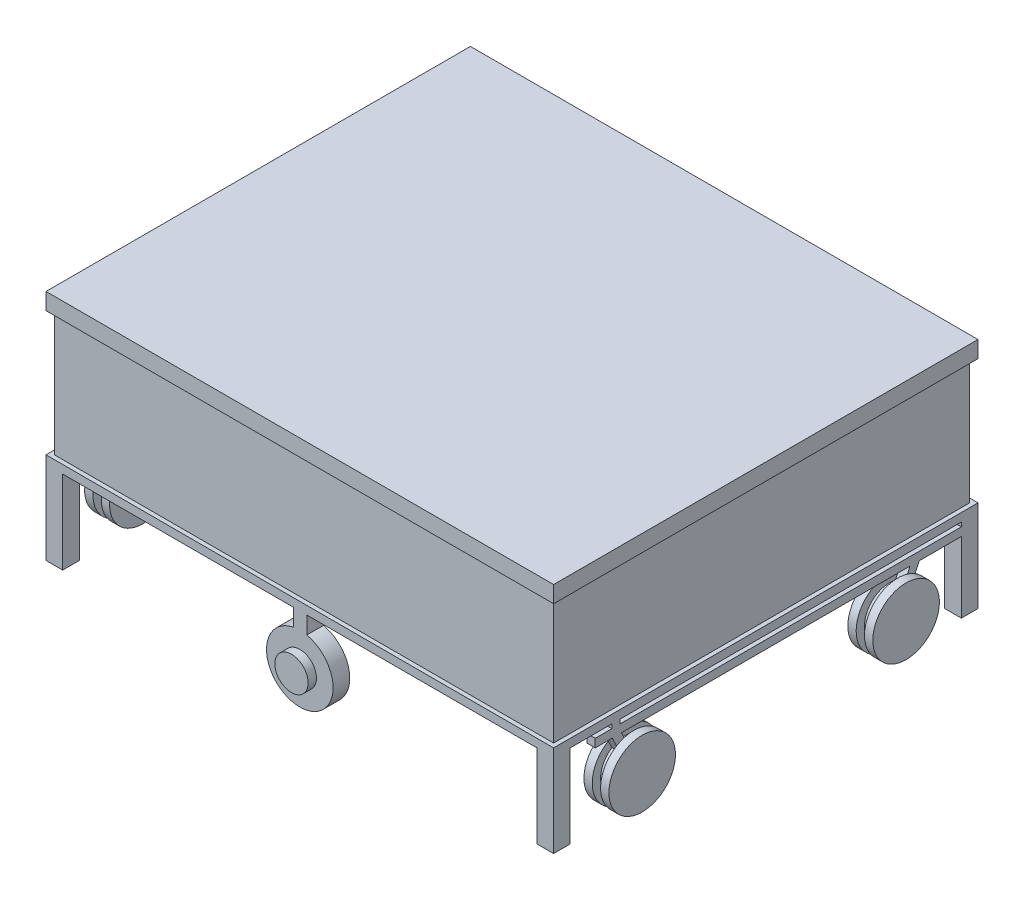
from build123d import *

# Parameters (mm, degrees)
SKETCH2_W            = 610
SKETCH2_H            = 110
BOSS_EXTRUDE1_DEPTH  = 510
SKETCH3_W            = 500
SKETCH3_H            = 470
CUT_EXTRUDE1_DEPTH   = 510
SKETCH4_W            = 570
SKETCH4_H            = 100
CUT_EXTRUDE2_DEPTH   = 510
SKETCH5_W            = 470
SKETCH5_H            = 100
CUT_EXTRUDE4_DEPTH   = 610
SKETCH7_W            = 600
SKETCH7_H            = 500
BOSS_EXTRUDE2_DEPTH  = 100
SKETCH8_W            = 500
SKETCH8_H            = 400
BOSS_EXTRUDE3_DEPTH  = 20
SKETCH9_W            = 600
SKETCH9_H            = 500
BOSS_EXTRUDE4_DEPTH  = 50
SKETCH10_R           = 30
CUT_EXTRUDE5_DEPTH   = 600
BOSS_EXTRUDE5_DEPTH  = 10
BOSS_EXTRUDE11_DEPTH = 10
SKETCH17_R           = 40
BOSS_EXTRUDE12_DEPTH = 10
BOSS_EXTRUDE13_START = 10
SKETCH18_R           = 40
BOSS_EXTRUDE13_DEPTH = 10
SKETCH19_W           = 440
SKETCH19_H           = 10
SKETCH19_W_2         = 9.610886645
SKETCH19_H_2         = 15
BOSS_EXTRUDE14_DEPTH = 10
BOSS_EXTRUDE15_START = -10
BOSS_EXTRUDE15_DEPTH = 10
BOSS_EXTRUDE16_START = 10
SKETCH21_R           = 40
BOSS_EXTRUDE16_DEPTH = 10
SKETCH22_R           = 40
BOSS_EXTRUDE17_DEPTH = 10
CUT_EXTRUDE7_DEPTH   = 610
SKETCH24_R           = 40
SKETCH24_W           = 16
SKETCH24_H           = 60
BOSS_EXTRUDE18_DEPTH = 20
SKETCH25_R           = 20
CUT_EXTRUDE8_DEPTH   = 20
BOSS_EXTRUDE19_START = -20
BOSS_EXTRUDE19_DEPTH = 20
SKETCH27_R           = 20
BOSS_EXTRUDE20_DEPTH = 10
SKETCH28_R           = 20
BOSS_EXTRUDE21_DEPTH = 10
SKETCH29_R           = 20
BOSS_EXTRUDE22_DEPTH = 10
SKETCH30_R           = 20
BOSS_EXTRUDE23_DEPTH = 10
SKETCH31_W           = 600
SKETCH31_H           = 500
BOSS_EXTRUDE24_DEPTH = 70
SKETCH32_W           = 610
SKETCH32_H           = 510
BOSS_EXTRUDE25_DEPTH = 20


with BuildPart() as part:
    # Sketch2 → Boss-Extrude1 (new body)
    with BuildSketch(Plane.XY):
        with Locations((305, -55)):
            Rectangle(SKETCH2_W, SKETCH2_H)
    extrude(amount=BOSS_EXTRUDE1_DEPTH)

    # Sketch3 → Cut-Extrude1 (cut)
    with BuildSketch(Plane(origin=(0, 0, 0), x_dir=(1, 0, 0), z_dir=(0, 1, 0))):
        with Locations((305, -255)):
            Rectangle(SKETCH3_W, SKETCH3_H)
    extrude(amount=-CUT_EXTRUDE1_DEPTH, mode=Mode.SUBTRACT)

    # Sketch4 → Cut-Extrude2 (cut)
    with BuildSketch(Plane.XY.offset(510)):
        with Locations((305, -60)):
            Rectangle(SKETCH4_W, SKETCH4_H)
    extrude(amount=-CUT_EXTRUDE2_DEPTH, mode=Mode.SUBTRACT)

    # Sketch5 → Cut-Extrude4 (cut)
    with BuildSketch(Plane(origin=(610, 0, 0), x_dir=(0, 0, -1), z_dir=(1, 0, 0))):
        with Locations((-255, -60)):
            Rectangle(SKETCH5_W, SKETCH5_H)
    extrude(amount=-CUT_EXTRUDE4_DEPTH, mode=Mode.SUBTRACT)

    # Sketch7 → Boss-Extrude2 (add)
    with BuildSketch(Plane(origin=(0, 0, 0), x_dir=(1, 0, 0), z_dir=(0, 1, 0))):
        with Locations((305, -255)):
            Rectangle(SKETCH7_W, SKETCH7_H)
    extrude(amount=BOSS_EXTRUDE2_DEPTH)

    # Sketch8 → Boss-Extrude3 (add)
    with BuildSketch(Plane(origin=(0, 100, 0), x_dir=(1, 0, 0), z_dir=(0, 1, 0))):
        with Locations((305, -255)):
            Rectangle(SKETCH8_W, SKETCH8_H)
    extrude(amount=BOSS_EXTRUDE3_DEPTH)

    # Sketch9 → Boss-Extrude4 (add)
    with BuildSketch(Plane(origin=(0, 120, 0), x_dir=(1, 0, 0), z_dir=(0, 1, 0))):
        with Locations((305, -255)):
            Rectangle(SKETCH9_W, SKETCH9_H)
    extrude(amount=BOSS_EXTRUDE4_DEPTH)

    # Sketch10 → Cut-Extrude5 (cut)
    with BuildSketch(Plane.XY.offset(505)):
        with Locations((5, 170)):
            Circle(SKETCH10_R)
        with Locations((605, 170)):
            Circle(SKETCH10_R)
    extrude(amount=-CUT_EXTRUDE5_DEPTH, mode=Mode.SUBTRACT)

    # Sketch11 → Boss-Extrude5 (add)
    with BuildSketch(Plane(origin=(610, 0, 0), x_dir=(0, 0, -1), z_dir=(1, 0, 0))):
        Polygon((-430, -10), (-440, -10), (-440, -15), (-460, -15), (-460, -25), (-20, -25), (-20, -15), (-430, -15), align=None)
    extrude(amount=-BOSS_EXTRUDE5_DEPTH)

    # Sketch12 → Boss-Extrude11 (add)
    with BuildSketch(Plane(origin=(610, 0, 0), x_dir=(0, 0, -1), z_dir=(1, 0, 0))):
        with BuildLine():
            ThreePointArc((-420.702259986, -40.858371626), (-425.464970475, -42.455807236), (-429.894360229, -44.825557887))
            Line((-429.894360229, -44.825557887), (-424.207792479, -56.428405784))
            Line((-424.207792479, -56.428405784), (-415.22824797, -52.027521736))
            Line((-415.22824797, -52.027521736), (-420.702259986, -40.858371626))
        make_face()
        with BuildLine():
            Line((-424.207792479, -56.428405784), (-429.894360229, -44.825557887))
            ThreePointArc((-429.894360229, -44.825557887), (-427.903595608, -96.358231495), (-383.577269058, -70))
            ThreePointArc((-383.577269058, -70), (-395.053631832, -46.401803799), (-420.702259986, -40.858371626))
            Line((-420.702259986, -40.858371626), (-415.22824797, -52.027521736))
            Line((-415.22824797, -52.027521736), (-424.207792479, -56.428405784))
        make_face()
        with BuildLine():
            ThreePointArc((-80.105639771, -44.825557887), (-84.535029525, -42.455807236), (-89.297740014, -40.858371626))
            Line((-89.297740014, -40.858371626), (-94.77175203, -52.027521736))
            Line((-94.77175203, -52.027521736), (-85.792207521, -56.428405784))
            Line((-85.792207521, -56.428405784), (-80.105639771, -44.825557887))
        make_face()
        with BuildLine():
            Line((-94.77175203, -52.027521736), (-89.297740014, -40.858371626))
            ThreePointArc((-89.297740014, -40.858371626), (-120.020927143, -88.523637226), (-66.422730942, -70))
            ThreePointArc((-66.422730942, -70), (-70.064499447, -55.673673449), (-80.105639771, -44.825557887))
            Line((-80.105639771, -44.825557887), (-85.792207521, -56.428405784))
            Line((-85.792207521, -56.428405784), (-94.77175203, -52.027521736))
        make_face()
        with BuildLine():
            Line((-70.389113355, -25), (-81.525535686, -25))
            Line((-81.525535686, -25), (-89.297740014, -40.858371626))
            ThreePointArc((-89.297740014, -40.858371626), (-84.535029525, -42.455807236), (-80.105639771, -44.825557887))
            Line((-80.105639771, -44.825557887), (-70.389113355, -25))
        make_face()
        with BuildLine():
            Line((-428.474464314, -25), (-439.610886645, -25))
            Line((-439.610886645, -25), (-429.894360229, -44.825557887))
            ThreePointArc((-429.894360229, -44.825557887), (-425.464970475, -42.455807236), (-420.702259986, -40.858371626))
            Line((-420.702259986, -40.858371626), (-428.474464314, -25))
        make_face()
    extrude(amount=-BOSS_EXTRUDE11_DEPTH)

    # Sketch17 → Boss-Extrude12 (add)
    with BuildSketch(Plane(origin=(610, 0, 0), x_dir=(0, 0, -1), z_dir=(1, 0, 0))):
        with Locations(Location((-413.577269058, -70, 0), (0, 0, 121.234333219))):
            Circle(SKETCH17_R)
        with Locations(Location((-96.422730942, -70, 0), (0, 0, 180))):
            Circle(SKETCH17_R)
    extrude(amount=BOSS_EXTRUDE12_DEPTH)

    # Sketch18 → Boss-Extrude13 (add)
    with BuildSketch(Plane.ZY.offset(-600).offset(BOSS_EXTRUDE13_START)):
        with Locations((96.422730942, -70)):
            Circle(SKETCH18_R)
        with Locations(Location((413.577269058, -70, 0), (0, 0, 58.765666781))):
            Circle(SKETCH18_R)
    extrude(amount=-BOSS_EXTRUDE13_DEPTH)

    # Sketch19 → Boss-Extrude14 (add)
    with BuildSketch(Plane.ZY):
        with Locations((240, -20)):
            Rectangle(SKETCH19_W, SKETCH19_H)
        with Locations((434.805443323, -17.5)):
            Rectangle(SKETCH19_W_2, SKETCH19_H_2)
    extrude(amount=-BOSS_EXTRUDE14_DEPTH)

    # Sketch20 → Boss-Extrude15 (add)
    with BuildSketch(Plane.ZY.offset(BOSS_EXTRUDE15_START)):
        with BuildLine():
            ThreePointArc((89.315872093, -40.853944396), (84.543598521, -42.452110554), (80.105639771, -44.825557887))
            Line((80.105639771, -44.825557887), (85.792207521, -56.428405784))
            Line((85.792207521, -56.428405784), (94.788121878, -52.019498857))
            Line((94.788121878, -52.019498857), (89.315872093, -40.853944396))
        make_face()
        with BuildLine():
            Line((85.792207521, -56.428405784), (80.105639771, -44.825557887))
            ThreePointArc((80.105639771, -44.825557887), (82.096404392, -96.358231495), (126.422730942, -70))
            ThreePointArc((126.422730942, -70), (114.953708177, -46.407567257), (89.315872093, -40.853944396))
            Line((89.315872093, -40.853944396), (94.788121878, -52.019498857))
            Line((94.788121878, -52.019498857), (85.792207521, -56.428405784))
        make_face()
        with BuildLine():
            Line((81.545837554, -25), (70.389113355, -25))
            Line((70.389113355, -25), (80.105639771, -44.825557887))
            ThreePointArc((80.105639771, -44.825557887), (84.543598521, -42.452110554), (89.315872093, -40.853944396))
            Line((89.315872093, -40.853944396), (81.545837554, -25))
        make_face()
        with BuildLine():
            ThreePointArc((429.894360229, -44.825557887), (425.456401479, -42.452110554), (420.684127907, -40.853944396))
            Line((420.684127907, -40.853944396), (415.211878122, -52.019498857))
            Line((415.211878122, -52.019498857), (424.207792479, -56.428405784))
            Line((424.207792479, -56.428405784), (429.894360229, -44.825557887))
        make_face()
        with BuildLine():
            Line((415.211878122, -52.019498857), (420.684127907, -40.853944396))
            ThreePointArc((420.684127907, -40.853944396), (389.984836315, -88.530977234), (443.577269058, -70))
            ThreePointArc((443.577269058, -70), (439.935500553, -55.673673449), (429.894360229, -44.825557887))
            Line((429.894360229, -44.825557887), (424.207792479, -56.428405784))
            Line((424.207792479, -56.428405784), (415.211878122, -52.019498857))
        make_face()
        with BuildLine():
            Line((439.610886645, -25), (428.454162446, -25))
            Line((428.454162446, -25), (420.684127907, -40.853944396))
            ThreePointArc((420.684127907, -40.853944396), (425.456401479, -42.452110554), (429.894360229, -44.825557887))
            Line((429.894360229, -44.825557887), (439.610886645, -25))
        make_face()
    extrude(amount=BOSS_EXTRUDE15_DEPTH)

    # Sketch21 → Boss-Extrude16 (add)
    with BuildSketch(Plane.ZY.offset(BOSS_EXTRUDE16_START)):
        with Locations((96.422730942, -70)):
            Circle(SKETCH21_R)
        with Locations(Location((413.577269058, -70, 0), (0, 0, 58.765666781))):
            Circle(SKETCH21_R)
    extrude(amount=-BOSS_EXTRUDE16_DEPTH)

    # Sketch22 → Boss-Extrude17 (add)
    with BuildSketch(Plane(origin=(10, 0, 0), x_dir=(0, 0, -1), z_dir=(1, 0, 0))):
        with Locations(Location((-413.577269058, -70, 0), (0, 0, 121.234333219))):
            Circle(SKETCH22_R)
        with Locations(Location((-96.422730942, -70, 0), (0, 0, 180))):
            Circle(SKETCH22_R)
    extrude(amount=BOSS_EXTRUDE17_DEPTH)

    # Sketch23 → Cut-Extrude7 (cut)
    with BuildSketch(Plane.ZY.offset(-5)):
        with BuildLine():
            Line((225, 135), (245, 135))
            ThreePointArc((245, 135), (250, 130), (245, 125))
            Line((245, 125), (225, 125))
            ThreePointArc((225, 125), (220, 130), (225, 135))
        make_face()
        with BuildLine():
            Line((285, 135), (265, 135))
            ThreePointArc((265, 135), (260, 130), (265, 125))
            Line((265, 125), (285, 125))
            ThreePointArc((285, 125), (290, 130), (285, 135))
        make_face()
    extrude(amount=-CUT_EXTRUDE7_DEPTH, mode=Mode.SUBTRACT)

    # Sketch24 → Boss-Extrude18 (add)
    with BuildSketch(Plane.XY.offset(510)):
        with Locations((305, -70)):
            Circle(SKETCH24_R)
        with Locations((305.368819506, -40)):
            Rectangle(SKETCH24_W, SKETCH24_H)
    extrude(amount=-BOSS_EXTRUDE18_DEPTH)

    # Sketch25 → Cut-Extrude8 (cut)
    with BuildSketch(Plane.XY.offset(510)):
        with Locations((305, -70)):
            Circle(SKETCH25_R)
    extrude(amount=-CUT_EXTRUDE8_DEPTH, mode=Mode.SUBTRACT)

    # Sketch26 → Boss-Extrude19 (add)
    with BuildSketch(Plane(origin=(0, 0, 0), x_dir=(-1, 0, 0), z_dir=(0, 0, -1)).offset(BOSS_EXTRUDE19_START)):
        with BuildLine():
            ThreePointArc((-297.368819506, -30.734683444), (-305.376425527, -30.001771241), (-313.368819506, -30.885260322))
            Line((-313.368819506, -30.885260322), (-313.368819506, -51.835120147))
            ThreePointArc((-313.368819506, -51.835120147), (-305.402430597, -50.00404917), (-297.368819506, -51.513110476))
            Line((-297.368819506, -51.513110476), (-297.368819506, -30.734683444))
        make_face()
        with BuildLine():
            Line((-313.368819506, -51.835120147), (-313.368819506, -30.885260322))
            ThreePointArc((-313.368819506, -30.885260322), (-330.152010056, -101.102674967), (-265, -70))
            ThreePointArc((-265, -70), (-274.135398757, -44.55640768), (-297.368819506, -30.734683444))
            Line((-297.368819506, -30.734683444), (-297.368819506, -51.513110476))
            ThreePointArc((-297.368819506, -51.513110476), (-288.377370697, -58.878480542), (-285, -70))
            ThreePointArc((-285, -70), (-315.784795081, -86.843045896), (-313.368819506, -51.835120147))
        make_face()
        with BuildLine():
            Line((-297.368819506, -10), (-313.368819506, -10))
            Line((-313.368819506, -10), (-313.368819506, -30.885260322))
            ThreePointArc((-313.368819506, -30.885260322), (-305.376425527, -30.001771241), (-297.368819506, -30.734683444))
            Line((-297.368819506, -30.734683444), (-297.368819506, -10))
        make_face()
    extrude(amount=BOSS_EXTRUDE19_DEPTH)

    # Sketch31 → Boss-Extrude24 (add)
    with BuildSketch(Plane(origin=(0, 100, 0), x_dir=(1, 0, 0), z_dir=(0, 1, 0))):
        with Locations((305, -255)):
            Rectangle(SKETCH31_W, SKETCH31_H)
    extrude(amount=BOSS_EXTRUDE24_DEPTH)

    # Sketch32 → Boss-Extrude25 (add)
    with BuildSketch(Plane(origin=(0, 170, 0), x_dir=(1, 0, 0), z_dir=(0, 1, 0))):
        with Locations((305, -255)):
            Rectangle(SKETCH32_W, SKETCH32_H)
    extrude(amount=-BOSS_EXTRUDE25_DEPTH)


with BuildPart() as body_2:
    # Sketch27 → Boss-Extrude20 (new body)
    with BuildSketch(Plane(origin=(0, 0, 0), x_dir=(-1, 0, 0), z_dir=(0, 0, -1))):
        with Locations((-305, -70)):
            Circle(SKETCH27_R)
    extrude(amount=BOSS_EXTRUDE20_DEPTH)


with BuildPart() as body_3:
    # Sketch28 → Boss-Extrude21 (new body)
    with BuildSketch(Plane.XY.offset(20)):
        with Locations((305, -70)):
            Circle(SKETCH28_R)
    extrude(amount=BOSS_EXTRUDE21_DEPTH)


with BuildPart() as body_4:
    # Sketch29 → Boss-Extrude22 (new body)
    with BuildSketch(Plane.XY.offset(510)):
        with Locations((305, -70)):
            Circle(SKETCH29_R)
    extrude(amount=BOSS_EXTRUDE22_DEPTH)


with BuildPart() as body_5:
    # Sketch30 → Boss-Extrude23 (new body)
    with BuildSketch(Plane(origin=(0, 0, 490), x_dir=(-1, 0, 0), z_dir=(0, 0, -1))):
        with Locations((-305, -70)):
            Circle(SKETCH30_R)
    extrude(amount=BOSS_EXTRUDE23_DEPTH)


solid = Compound([part.part, body_2.part, body_3.part, body_4.part, body_5.part])
